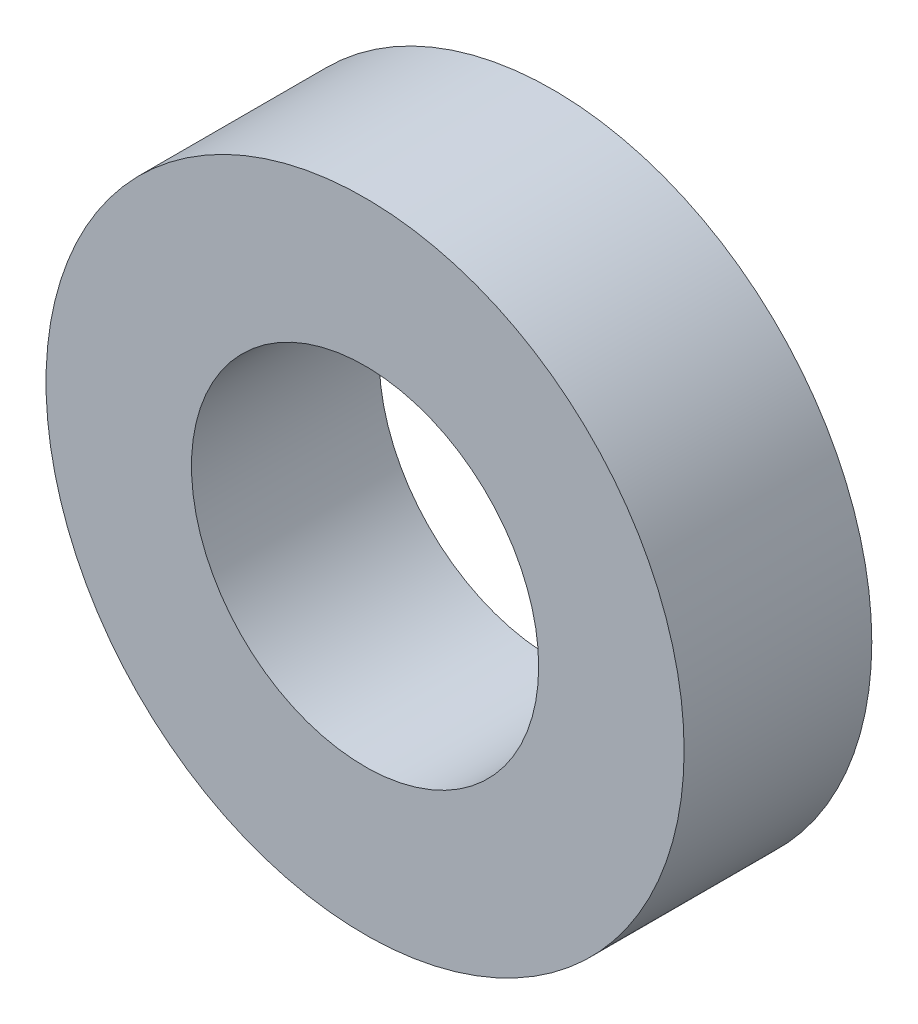
from build123d import *

# Parameters (mm, degrees)
SKETCH_2_R      = 6.8
SKETCH_2_R_2    = 3.7
EXTRUDE_1_DEPTH = 2


with BuildPart() as part:
    # Эскиз2 → Бобышка-Вытянуть1 (new, symmetric)
    with BuildSketch(Plane.XY):
        Circle(SKETCH_2_R)
        Circle(SKETCH_2_R_2, mode=Mode.SUBTRACT)
    extrude(amount=EXTRUDE_1_DEPTH, both=True)


solid = part.part
